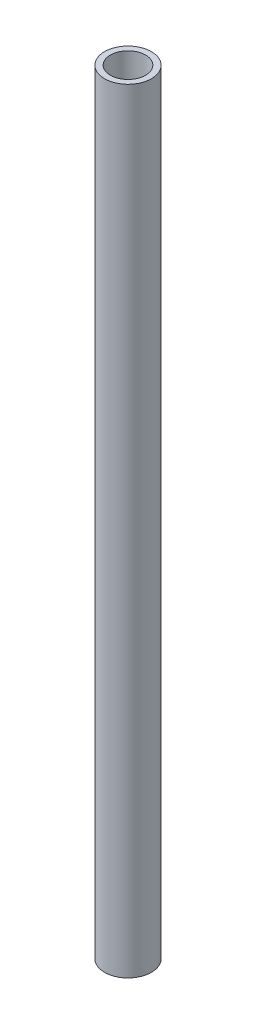
from build123d import *

# Parameters (mm, degrees)
SKETCH1_R           = 12.7
SKETCH1_R_2         = 9.525
BOSS_EXTRUDE2_DEPTH = 419.1


with BuildPart() as part:
    # Sketch1 → Boss-Extrude2 (new body)
    with BuildSketch(Plane(origin=(0, 0, 0), x_dir=(1, 0, 0), z_dir=(0, 1, 0))):
        with Locations(Location((-391.181668083, 212.743279788, 0), (0, 0, 270))):
            Circle(SKETCH1_R)
        with Locations(Location((-391.181668083, 212.743279788, 0), (0, 0, 270))):
            Circle(SKETCH1_R_2, mode=Mode.SUBTRACT)
    extrude(amount=BOSS_EXTRUDE2_DEPTH)


solid = part.part
